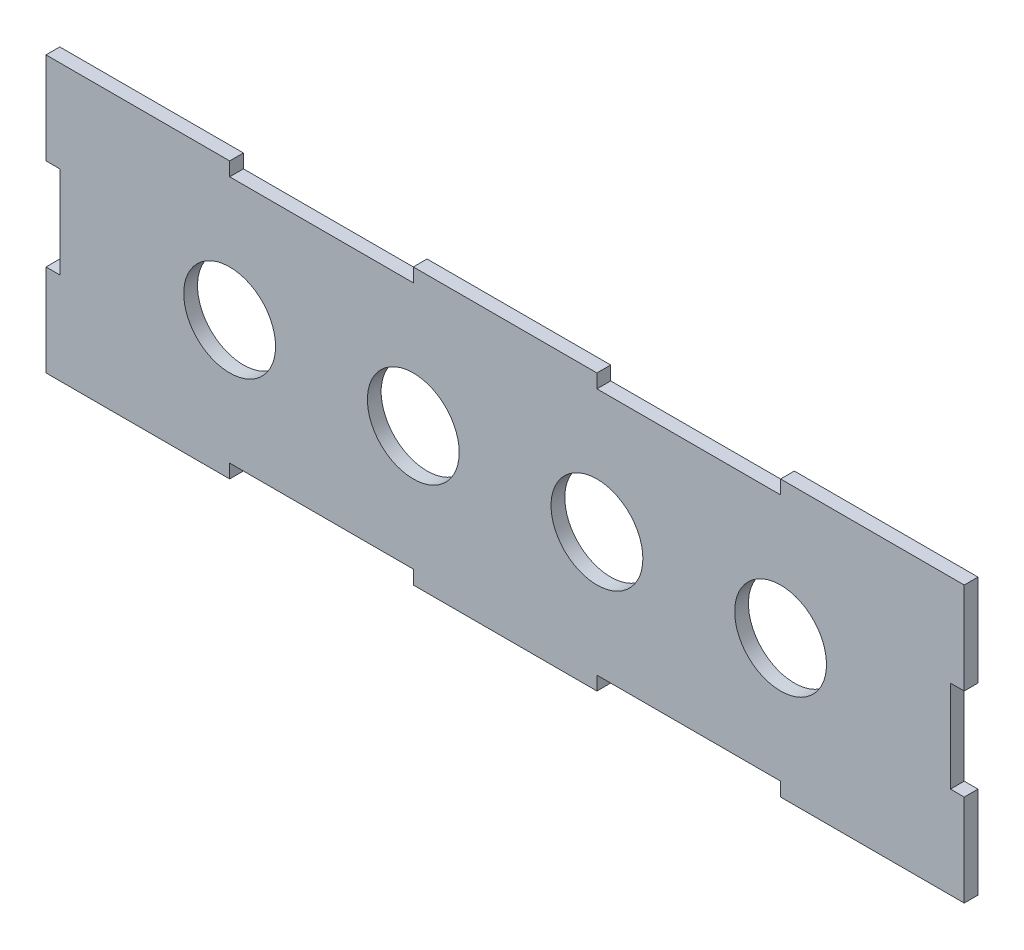
from build123d import *

# Parameters (mm, degrees)
BOSS_EXTRUDE1_DEPTH = 3
SKETCH2_R           = 10
CUT_EXTRUDE1_DEPTH  = 115.057003292


with BuildPart() as part:
    # Sketch1 → Boss-Extrude1 (new body)
    with BuildSketch(Plane.XY):
        Polygon((-50, 30), (-90, 30), (-90, 10), (-87, 10), (-87, -10), (-90, -10), (-90, -30), (-50, -30), (-50, -27), (-10, -27), (-10, -30), (30, -30), (30, -27), (70, -27), (70, -30), (71.400928912, -30), (110, -30), (110, -10), (107, -10), (107, 10), (110, 10), (110, 30), (71.400928912, 30), (70, 30), (70, 27), (30, 27), (30, 30), (-10, 30), (-10, 27), (-50, 27), align=None)
    extrude(amount=BOSS_EXTRUDE1_DEPTH)

    # Sketch2 → Cut-Extrude1 (cut, through all)
    with BuildSketch(Plane.XY.offset(3)):
        with Locations((-50, 0)):
            Circle(SKETCH2_R)
        with Locations((-10, 0)):
            Circle(SKETCH2_R)
        with Locations((30, 0)):
            Circle(SKETCH2_R)
        with Locations((70, 0)):
            Circle(SKETCH2_R)
    extrude(amount=-CUT_EXTRUDE1_DEPTH, mode=Mode.SUBTRACT)


solid = part.part
